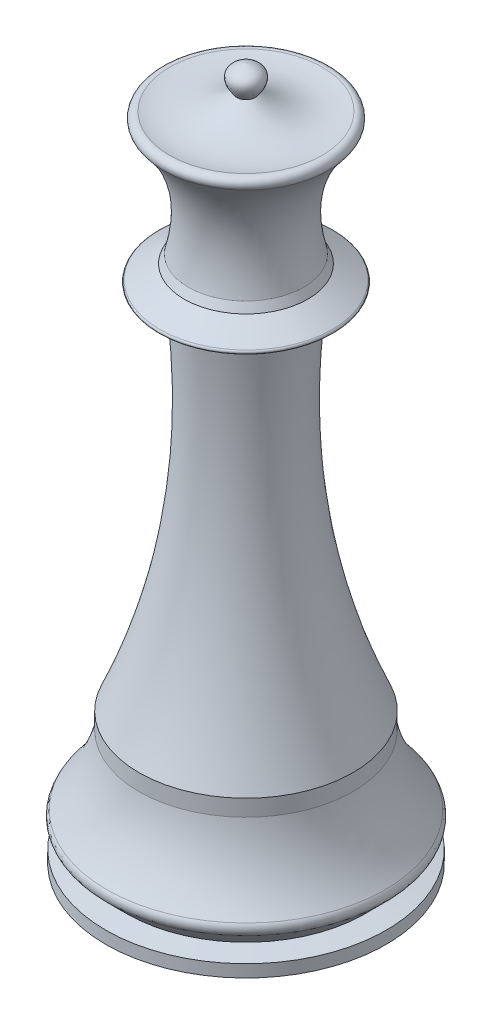
from build123d import *

# Parameters (mm, degrees)
FILLET1_R = 1
FILLET2_R = 0.75
FILLET3_R = 0.25


with BuildPart() as part:
    # Sketch1 → Revolve1 (revolve)
    with BuildSketch(Plane.XY, mode=Mode.PRIVATE) as revolve1_sk:
        with BuildLine():
            Line((0, 0), (17, 0))
            Line((17, 0), (17, 1.5))
            Line((17, 1.5), (14.449688693, 1.949688693))
            Line((14.449688693, 1.949688693), (17.5, 5))
            add(Edge.make_bspline(
                [(12.976411859, 14.03), (13.902117659, 8.737562454), (17.5, 5)],
                knots=[0, 0, 0, 1, 1, 1], degree=2))
            Line((12.976411859, 14.03), (12.976411859, 16.03))
            add(Edge.make_bspline(
                [(7, 60), (4.136028276, 36.595359513), (12.976411859, 16.03)],
                knots=[0, 0, 0, 1, 1, 1], degree=2))
            Line((7, 60), (11, 61))
            Line((11, 61), (7.5, 63))
            Line((7.5, 63), (7, 64))
            add(Edge.make_bspline(
                [(7, 64), (4.396490031, 74.070251116), (13, 80.5)],
                knots=[0, 0, 0, 1, 1, 1], degree=2))
            add(Edge.make_bspline(
                [(13, 80.5), (6.495844097, 76.758411128), (1.13326063, 81)],
                knots=[0, 0, 0, 1, 1, 1], degree=2))
            add(Edge.make_bspline(
                [(0, 84), (3.026484877, 83.415562524), (1.13326063, 81)],
                knots=[0, 0, 0, 1, 1, 1], degree=2))
            Line((0, 84), (0, 0))
        make_face()
    revolve(revolve1_sk.sketch.rotate(Axis((0, 84, 0), (0, -1, 0)), 90), axis=Axis((0, 84, 0), (0, -1, 0)))

    # Fillet1
    fillet1_edges = [part.edges().sort_by_distance(p)[0] for p in [
        (0, 5, -17.5),
    ]]
    fillet(fillet1_edges, radius=FILLET1_R)

    # Fillet2
    fillet2_edges = [part.edges().sort_by_distance(p)[0] for p in [
        (0, 80.5, -13),
    ]]
    fillet(fillet2_edges, radius=FILLET2_R)

    # Fillet3
    fillet3_edges = [part.edges().sort_by_distance(p)[0] for p in [
        (0, 61, -11),
    ]]
    fillet(fillet3_edges, radius=FILLET3_R)


solid = part.part
